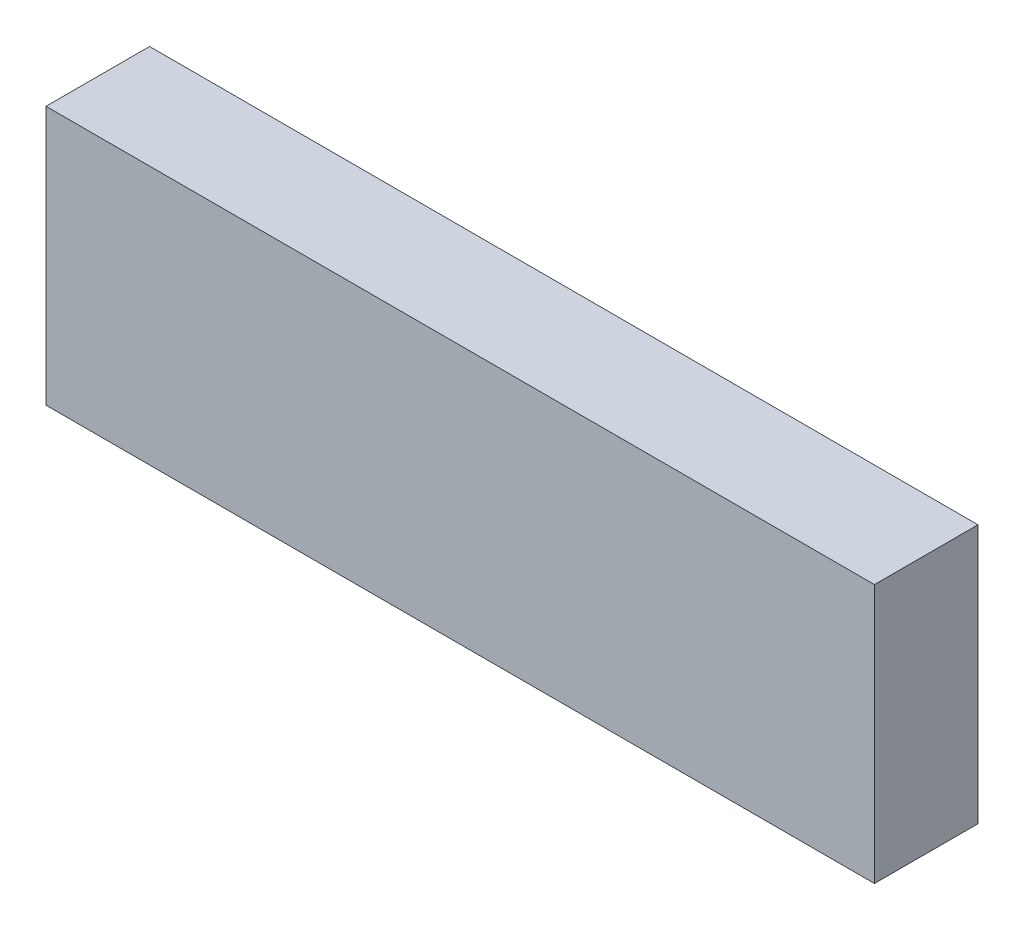
from build123d import *

# Parameters (mm, degrees)
CROQUIS1_W              = 80
CROQUIS1_H              = 25
SALIENTE_EXTRUIR1_DEPTH = 10


with BuildPart() as part:
    # Croquis1 → Saliente-Extruir1 (new body)
    with BuildSketch(Plane.XY):
        Rectangle(CROQUIS1_W, CROQUIS1_H)
    extrude(amount=SALIENTE_EXTRUIR1_DEPTH)


solid = part.part
